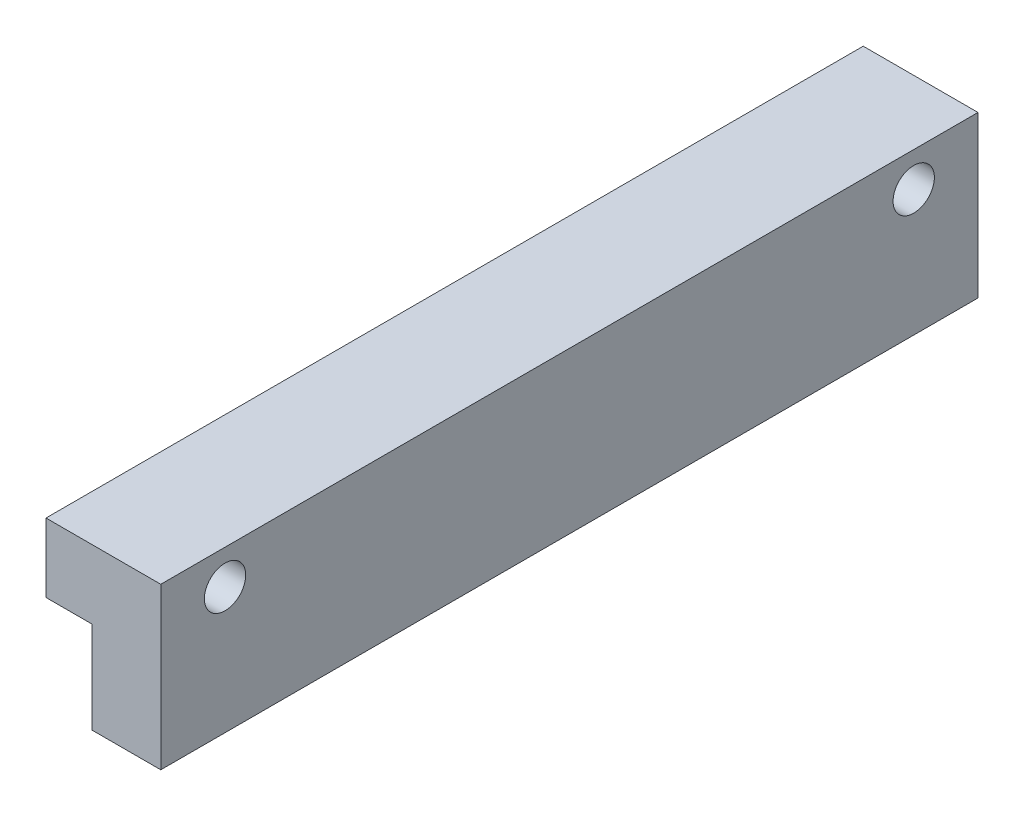
from build123d import *

# Parameters (mm, degrees)
AUFSATZ_LINEAR_AUSTRAGEN1_DEPTH = 89
M8_GEWINDEBOHRUNG1_D            = 6.8
M8_GEWINDEBOHRUNG1_DEPTH        = 18.25
M8_GEWINDEBOHRUNG1_TIP          = 2.042926105
F_9_0_9_DURCHMESSER_BOHRUNG1_D  = 9


with BuildPart() as part:
    # Skizze1 → Aufsatz-Linear austragen1 (new, symmetric)
    with BuildSketch(Plane.XY):
        Polygon((0, 0), (15, 0), (15, 35), (-10, 35), (-10, 20), (0, 20), align=None)
    extrude(amount=AUFSATZ_LINEAR_AUSTRAGEN1_DEPTH, both=True)

    # M8 Gewindebohrung1
    with Locations(Plane(origin=(0, 0, 0), x_dir=(-1, 0, 0), z_dir=(0, -1, 0))):
        with Locations((-7.5, -70), (-7.5, 70)):
            Hole(M8_GEWINDEBOHRUNG1_D / 2, depth=M8_GEWINDEBOHRUNG1_DEPTH)
            with Locations((0, 0, -(M8_GEWINDEBOHRUNG1_DEPTH + M8_GEWINDEBOHRUNG1_TIP / 2))):  # 118° drill point
                Cone(0, M8_GEWINDEBOHRUNG1_D / 2, M8_GEWINDEBOHRUNG1_TIP, mode=Mode.SUBTRACT)

    # Ø9.0 (9) Durchmesser Bohrung1 (through all)
    with Locations(Plane(origin=(15, 0, 0), x_dir=(0, 0, -1), z_dir=(1, 0, 0))):
        with Locations((-75, 27.5), (75, 27.5)):
            Hole(F_9_0_9_DURCHMESSER_BOHRUNG1_D / 2)


solid = part.part
